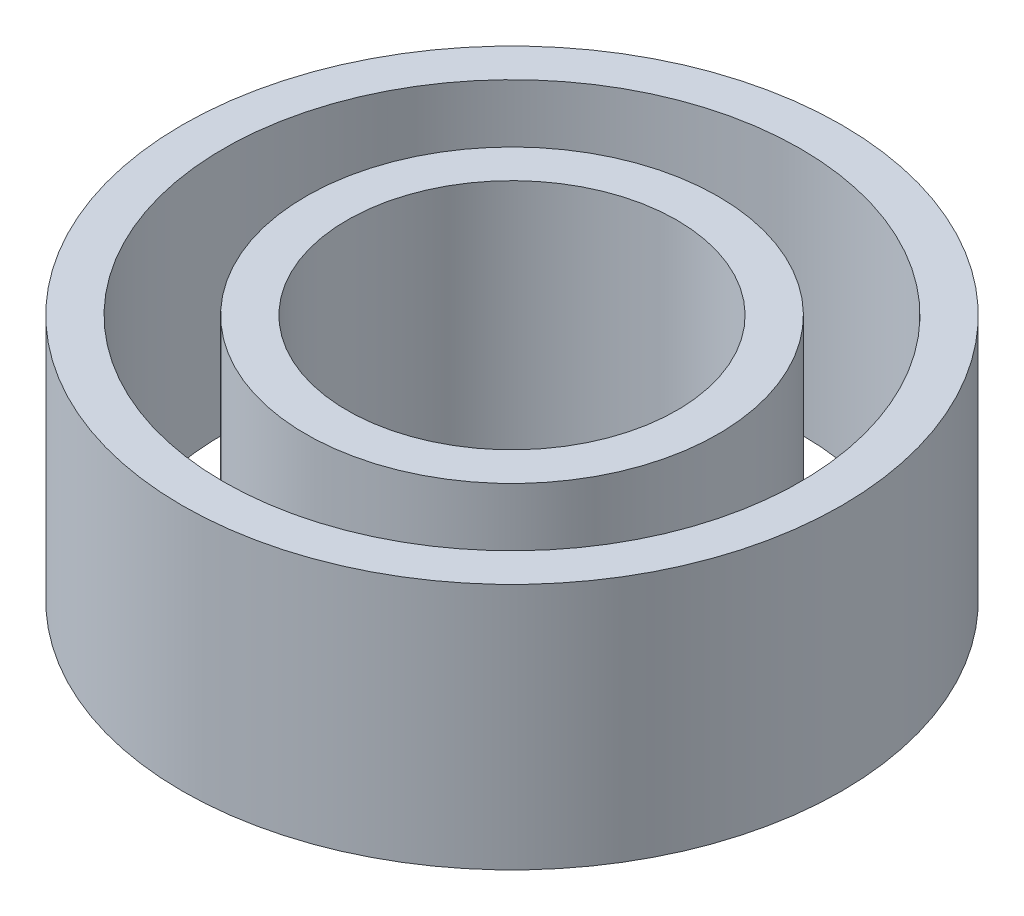
from build123d import *

# Parameters (mm, degrees)
ESQUISSE1_W = 0.5
ESQUISSE1_H = 3


with BuildPart() as part:
    # Esquisse1 → Révolution1 (revolve)
    with BuildSketch(Plane.XY, mode=Mode.PRIVATE) as r_volution1_sk:
        with Locations((2.25, 2.5)):
            Rectangle(ESQUISSE1_W, ESQUISSE1_H)
        with Locations((3.75, 2.5)):
            Rectangle(ESQUISSE1_W, ESQUISSE1_H)
    revolve(r_volution1_sk.sketch.rotate(Axis((0, 0, 0), (0, 1, 0)), 90), axis=Axis((0, 0, 0), (0, 1, 0)))


solid = part.part
